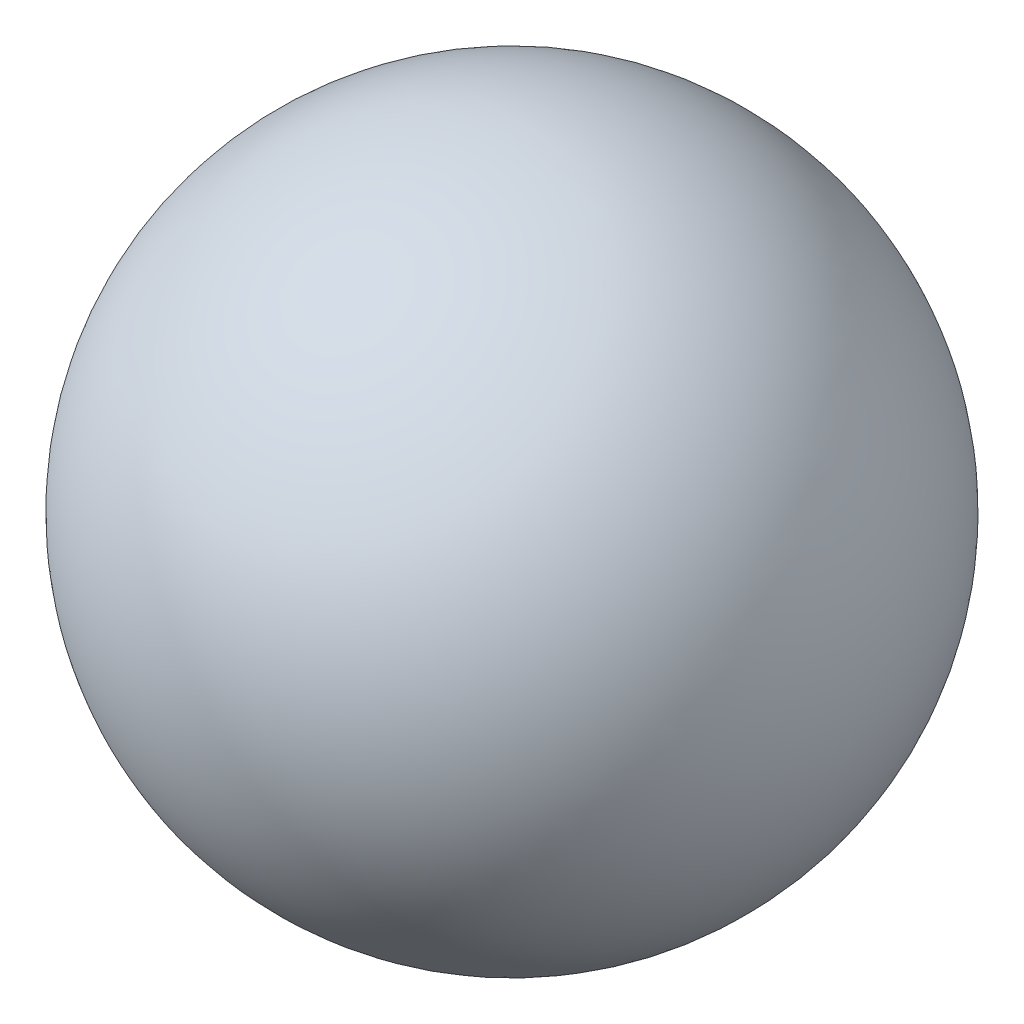
from build123d import *


with BuildPart() as part:
    # Sketch1 → Revolve1 (revolve)
    with BuildSketch(Plane(origin=(0, 0, 0), x_dir=(1, 0, 0), z_dir=(0, 1, 0))):
        with BuildLine():
            Line((0, 20.05), (0, 19.5125))
            ThreePointArc((0, 19.5125), (19.5125, 0), (0, -19.5125))
            Line((0, -19.5125), (0, -20.05))
            ThreePointArc((0, -20.05), (20.05, 0), (0, 20.05))
        make_face()
    revolve(axis=Axis((0, 0, -34.699535604), (0, 0, 1)))


solid = part.part
